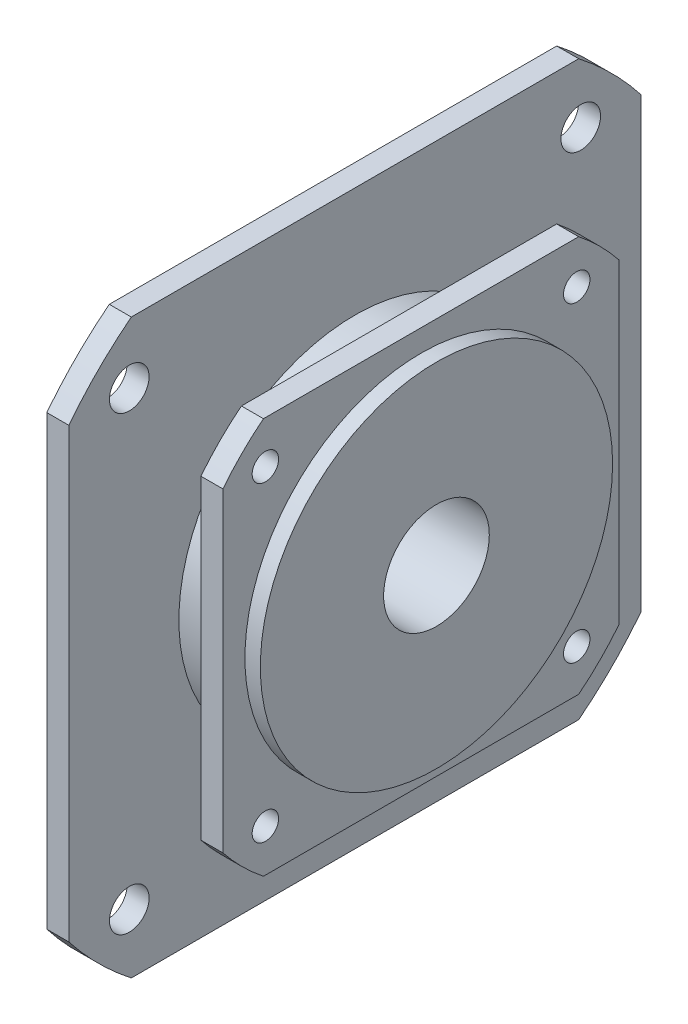
from build123d import *

# Parameters (mm, degrees)
SKETCH_1_R          = 4.5
EXTRUDE_1_DEPTH     = 5
SKETCH_2_R          = 55
CUT_EXTRUDE_1_DEPTH = 3
SKETCH_3_R          = 40
EXTRUDE_2_DEPTH     = 10
SKETCH_4_R          = 3
EXTRUDE_3_DEPTH     = 5
SKETCH_5_R          = 40
EXTRUDE_4_DEPTH     = 3.5
SKETCH_6_R          = 12
CUT_EXTRUDE_2_DEPTH = 95.880187605


with BuildPart() as part:
    # 草图1 → 凸台-拉伸1 (new body)
    with BuildSketch(Plane(origin=(0, 0, 0), x_dir=(0, 0, -1), z_dir=(1, 0, 0))):
        with BuildLine():
            Line((50.806003582, -65), (-50.806003582, -65))
            ThreePointArc((-50.806003582, -65), (-58.336309448, -58.336309448), (-65, -50.806003582))
            Line((-65, -50.806003582), (-65, 50.806003582))
            ThreePointArc((-65, 50.806003582), (-58.336309448, 58.336309448), (-50.806003582, 65))
            Line((-50.806003582, 65), (50.806003582, 65))
            ThreePointArc((50.806003582, 65), (58.336309448, 58.336309448), (65, 50.806003582))
            Line((65, 50.806003582), (65, -50.806003582))
            ThreePointArc((65, -50.806003582), (58.336309448, -58.336309448), (50.806003582, -65))
        make_face()
        with Locations((-51.265241636, 51.265241636)):
            Circle(SKETCH_1_R, mode=Mode.SUBTRACT)
        with Locations(Location((51.265241636, -51.265241636, 0), (0, 0, 180))):
            Circle(SKETCH_1_R, mode=Mode.SUBTRACT)
        with Locations((51.265241636, 51.265241636)):
            Circle(SKETCH_1_R, mode=Mode.SUBTRACT)
        with Locations(Location((-51.265241636, -51.265241636, 0), (0, 0, 180))):
            Circle(SKETCH_1_R, mode=Mode.SUBTRACT)
    extrude(amount=EXTRUDE_1_DEPTH)

    # 草图2 → 切除-拉伸1 (cut)
    with BuildSketch(Plane.ZY):
        Circle(SKETCH_2_R)
    extrude(amount=-CUT_EXTRUDE_1_DEPTH, mode=Mode.SUBTRACT)

    # 草图3 → 凸台-拉伸2 (add)
    with BuildSketch(Plane(origin=(5, 0, 0), x_dir=(0, 0, -1), z_dir=(1, 0, 0))):
        Circle(SKETCH_3_R)
    extrude(amount=EXTRUDE_2_DEPTH)

    # 草图4 → 凸台-拉伸3 (add)
    with BuildSketch(Plane(origin=(15, 0, 0), x_dir=(0, 0, -1), z_dir=(1, 0, 0))):
        with BuildLine():
            Line((35.794552658, -45), (-35.794552658, -45))
            ThreePointArc((-35.794552658, -45), (-40.658639918, -40.658639918), (-45, -35.794552658))
            Line((-45, -35.794552658), (-45, 35.794552658))
            ThreePointArc((-45, 35.794552658), (-40.658639918, 40.658639918), (-35.794552658, 45))
            Line((-35.794552658, 45), (35.794552658, 45))
            ThreePointArc((35.794552658, 45), (40.658639918, 40.658639918), (45, 35.794552658))
            Line((45, 35.794552658), (45, -35.794552658))
            ThreePointArc((45, -35.794552658), (40.658639918, -40.658639918), (35.794552658, -45))
        make_face()
        with Locations((-35.355339059, 35.355339059)):
            Circle(SKETCH_4_R, mode=Mode.SUBTRACT)
        with Locations(Location((35.355339059, -35.355339059, 0), (0, 0, 180))):
            Circle(SKETCH_4_R, mode=Mode.SUBTRACT)
        with Locations((35.355339059, 35.355339059)):
            Circle(SKETCH_4_R, mode=Mode.SUBTRACT)
        with Locations(Location((-35.355339059, -35.355339059, 0), (0, 0, 180))):
            Circle(SKETCH_4_R, mode=Mode.SUBTRACT)
    extrude(amount=EXTRUDE_3_DEPTH)

    # 草图5 → 凸台-拉伸4 (add)
    with BuildSketch(Plane(origin=(20, 0, 0), x_dir=(0, 0, -1), z_dir=(1, 0, 0))):
        Circle(SKETCH_5_R)
    extrude(amount=EXTRUDE_4_DEPTH)

    # 草图6 → 切除-拉伸2 (cut, through all)
    with BuildSketch(Plane(origin=(23.5, 0, 0), x_dir=(0, 0, -1), z_dir=(1, 0, 0))):
        Circle(SKETCH_6_R)
    extrude(amount=-CUT_EXTRUDE_2_DEPTH, mode=Mode.SUBTRACT)


solid = part.part
